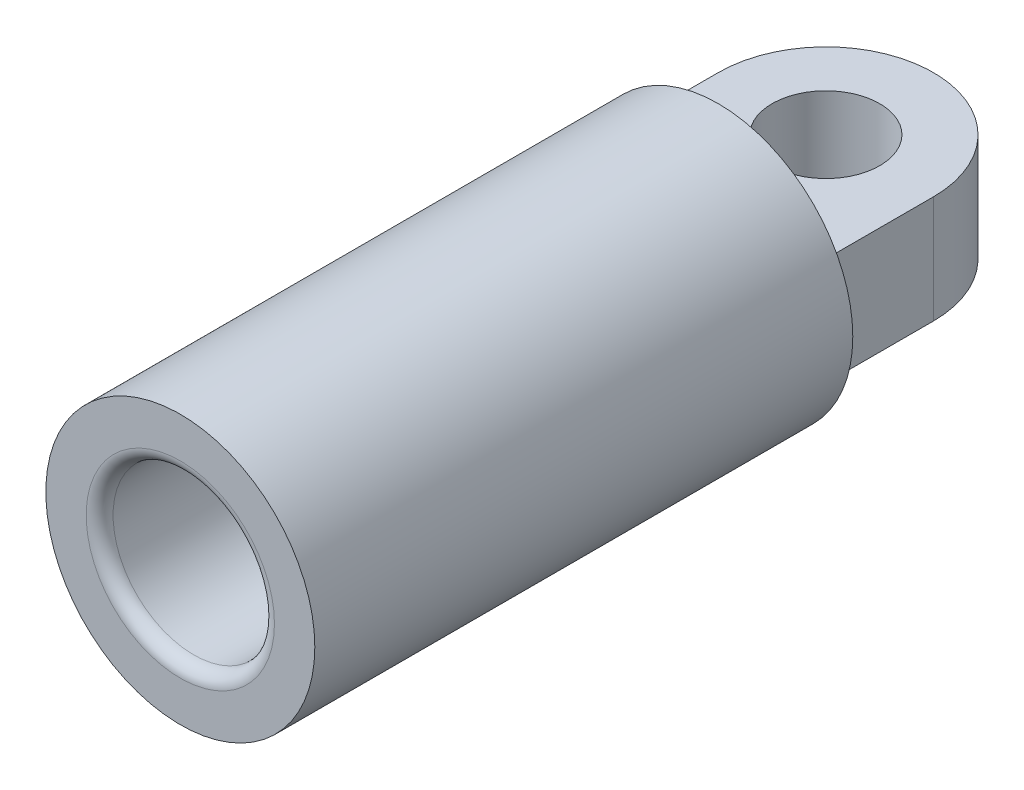
from build123d import *

# Parameters (mm, degrees)
SKETCH_1_R               = 25
EXTRUDE_1_DEPTH          = 30
SKETCH_2_R               = 25
EXTRUDE_2_DEPTH          = 250
SKETCH_3_W               = 40
SKETCH_3_H               = 10
EXTRUDE_4_DEPTH          = 40
CUT_EXTRUDE_1_DEPTH      = 323.877685819
CUT_EXTRUDE_1_DEPTH_BACK = 323.877685819
CUT_EXTRUDE_2_DEPTH      = 323.877685819
CUT_EXTRUDE_2_DEPTH_BACK = 323.877685819
SKETCH_7_R               = 10
SKETCH_8_R               = 25
CUT_EXTRUDE_3_DEPTH      = 180
SKETCH_9_R               = 15
CUT_EXTRUDE_4_DEPTH      = 30
FILLET_1_R               = 2.5


with BuildPart() as part:
    # 스케치1 → 보스-돌출1 (new body)
    with BuildSketch(Plane.XY):
        Circle(SKETCH_1_R)
    extrude(amount=-EXTRUDE_1_DEPTH)

    # 스케치2 → 보스-돌출2 (add)
    with BuildSketch(Plane(origin=(0, 0, -30), x_dir=(-1, 0, 0), z_dir=(0, 0, -1))):
        with Locations(Location((0, 0, 0), (0, 0, 180))):
            Circle(SKETCH_2_R)
    extrude(amount=EXTRUDE_2_DEPTH)

    # 스케치3 → 보스-돌출4 (add)
    with BuildSketch(Plane(origin=(0, 0, -280), x_dir=(-1, 0, 0), z_dir=(0, 0, -1))):
        with Locations((0, -5)):
            Rectangle(SKETCH_3_W, SKETCH_3_H)
        with Locations((0, 5)):
            Rectangle(SKETCH_3_W, SKETCH_3_H)
    extrude(amount=EXTRUDE_4_DEPTH)

    # 스케치6 → 컷-돌출1 (cut, two sides: drawn at the far end of the back side and taken through both)
    with BuildSketch(Plane(origin=(0, 10, 0), x_dir=(1, 0, 0), z_dir=(0, 1, 0)).offset(-CUT_EXTRUDE_1_DEPTH_BACK)):
        with BuildLine():
            ThreePointArc((-20, 300), (-14.142135624, 314.142135624), (0, 320))
            Line((0, 320), (-20, 320))
            Line((-20, 320), (-20, 300))
        make_face()
        with BuildLine():
            Line((20, 320), (0, 320))
            ThreePointArc((0, 320), (14.142135624, 314.142135624), (20, 300))
            Line((20, 300), (20, 320))
        make_face()
    extrude(amount=CUT_EXTRUDE_1_DEPTH + CUT_EXTRUDE_1_DEPTH_BACK, mode=Mode.SUBTRACT)

    # 스케치7 → 컷-돌출2 (cut, two sides: drawn at the far end of the back side and taken through both)
    with BuildSketch(Plane(origin=(0, 10, 0), x_dir=(1, 0, 0), z_dir=(0, 1, 0)).offset(-CUT_EXTRUDE_2_DEPTH_BACK)):
        with Locations(Location((0, 300, 0), (0, 0, 270))):
            Circle(SKETCH_7_R)
    extrude(amount=CUT_EXTRUDE_2_DEPTH + CUT_EXTRUDE_2_DEPTH_BACK, mode=Mode.SUBTRACT)

    # 스케치8 → 컷-돌출3 (cut)
    with BuildSketch(Plane.XY):
        Circle(SKETCH_8_R)
    extrude(amount=-CUT_EXTRUDE_3_DEPTH, mode=Mode.SUBTRACT)

    # 스케치9 → 컷-돌출4 (cut)
    with BuildSketch(Plane.XY.offset(-180)):
        Circle(SKETCH_9_R)
    extrude(amount=-CUT_EXTRUDE_4_DEPTH, mode=Mode.SUBTRACT)

    # 필렛1
    fillet_1_edges = [part.edges().sort_by_distance(p)[0] for p in [
        (-15, 0, -180),
    ]]
    fillet(fillet_1_edges, radius=FILLET_1_R)


solid = part.part
